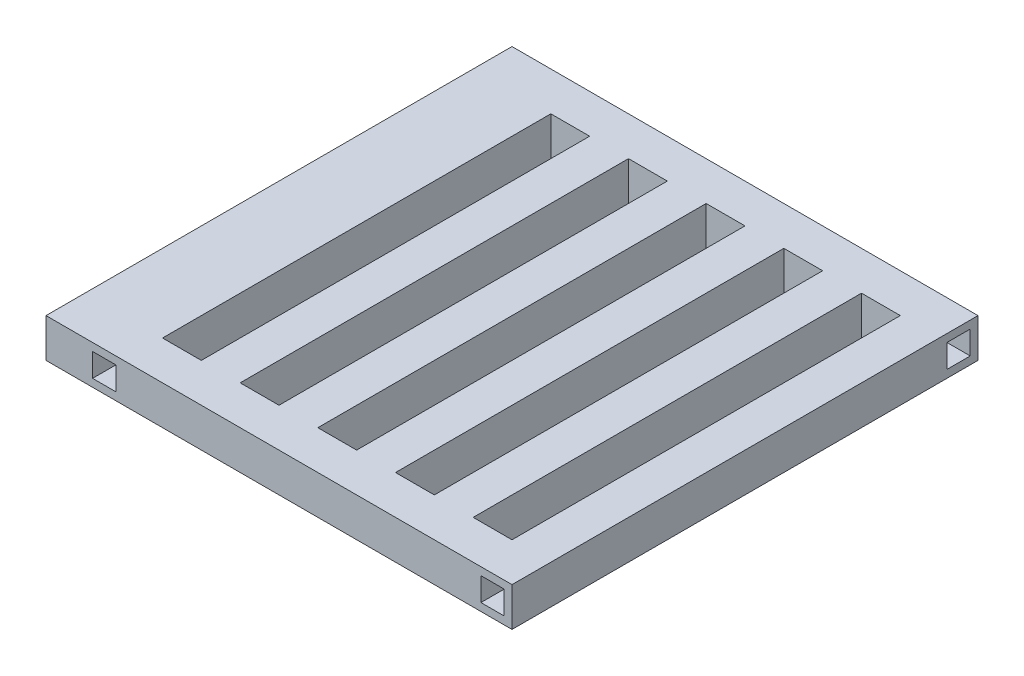
from build123d import *

# Parameters (mm, degrees)
SKETCH3_W           = 152.4
SKETCH3_H           = 152.4
BOSS_EXTRUDE1_DEPTH = 12.7
SKETCH5_W           = 147.32
SKETCH5_H           = 7.62
CUT_EXTRUDE1_DEPTH  = 12.7
SKETCH6_W           = 12.7
SKETCH6_H           = 127
CUT_EXTRUDE3_DEPTH  = 12.7
SKETCH8_W           = 7.62
SKETCH8_H           = 7.62
CUT_EXTRUDE4_DEPTH  = 25.4
SKETCH9_W           = 7.62
SKETCH9_H           = 7.62
CUT_EXTRUDE5_DEPTH  = 25.4
SKETCH10_W          = 7.508888552
SKETCH10_H          = 7.62
CUT_EXTRUDE6_DEPTH  = 25.4
SKETCH11_W          = 7.62
SKETCH11_H          = 7.62
BOSS_EXTRUDE3_DEPTH = 25.4
SKETCH12_W          = 7.62
SKETCH12_H          = 7.62
CUT_EXTRUDE7_DEPTH  = 25.4


with BuildPart() as part:
    # Sketch3 → Boss-Extrude1 (new body)
    with BuildSketch(Plane(origin=(0, 0, 0), x_dir=(1, 0, 0), z_dir=(0, 1, 0))):
        with Locations((-76.2, 76.2)):
            Rectangle(SKETCH3_W, SKETCH3_H)
    extrude(amount=BOSS_EXTRUDE1_DEPTH)

    # Sketch5 → Cut-Extrude1 (cut)
    with BuildSketch(Plane.ZY.offset(152.4)):
        with Locations((-76.2, 6.35)):
            Rectangle(SKETCH5_W, SKETCH5_H)
    extrude(amount=-CUT_EXTRUDE1_DEPTH, mode=Mode.SUBTRACT)

    # Sketch6 → Cut-Extrude3 (cut)
    with BuildSketch(Plane(origin=(0, 12.7, 0), x_dir=(1, 0, 0), z_dir=(0, 1, 0))):
        with Locations((-120.65, 76.2)):
            Rectangle(SKETCH6_W, SKETCH6_H)
        with Locations((-95.25, 76.2)):
            Rectangle(SKETCH6_W, SKETCH6_H)
        with Locations((-69.85, 76.2)):
            Rectangle(SKETCH6_W, SKETCH6_H)
        with Locations((-44.45, 76.2)):
            Rectangle(SKETCH6_W, SKETCH6_H)
        with Locations((-19.05, 76.2)):
            Rectangle(SKETCH6_W, SKETCH6_H)
    extrude(amount=-CUT_EXTRUDE3_DEPTH, mode=Mode.SUBTRACT)

    # Sketch8 → Cut-Extrude4 (cut)
    with BuildSketch(Plane(origin=(0, 0, 0), x_dir=(0, 0, -1), z_dir=(1, 0, 0))):
        with Locations((146.05, 6.35)):
            Rectangle(SKETCH8_W, SKETCH8_H)
        with Locations((6.35, 6.35)):
            Rectangle(SKETCH8_W, SKETCH8_H)
    extrude(amount=-CUT_EXTRUDE4_DEPTH, mode=Mode.SUBTRACT)

    # Sketch9 → Cut-Extrude5 (cut)
    with BuildSketch(Plane.XY):
        with Locations((-133.35, 6.35)):
            Rectangle(SKETCH9_W, SKETCH9_H)
    extrude(amount=-CUT_EXTRUDE5_DEPTH, mode=Mode.SUBTRACT)

    # Sketch10 → Cut-Extrude6 (cut)
    with BuildSketch(Plane(origin=(0, 0, -152.4), x_dir=(-1, 0, 0), z_dir=(0, 0, -1))):
        with Locations((133.405555724, 6.35)):
            Rectangle(SKETCH10_W, SKETCH10_H)
    extrude(amount=-CUT_EXTRUDE6_DEPTH, mode=Mode.SUBTRACT)

    # Sketch11 → Boss-Extrude3 (add)
    with BuildSketch(Plane(origin=(-25.4, 0, 0), x_dir=(0, 0, -1), z_dir=(1, 0, 0))):
        with Locations((6.35, 6.35)):
            Rectangle(SKETCH11_W, SKETCH11_H)
    extrude(amount=BOSS_EXTRUDE3_DEPTH)

    # Sketch12 → Cut-Extrude7 (cut)
    with BuildSketch(Plane.XY):
        with Locations((-6.35, 6.35)):
            Rectangle(SKETCH12_W, SKETCH12_H)
    extrude(amount=-CUT_EXTRUDE7_DEPTH, mode=Mode.SUBTRACT)


solid = part.part
